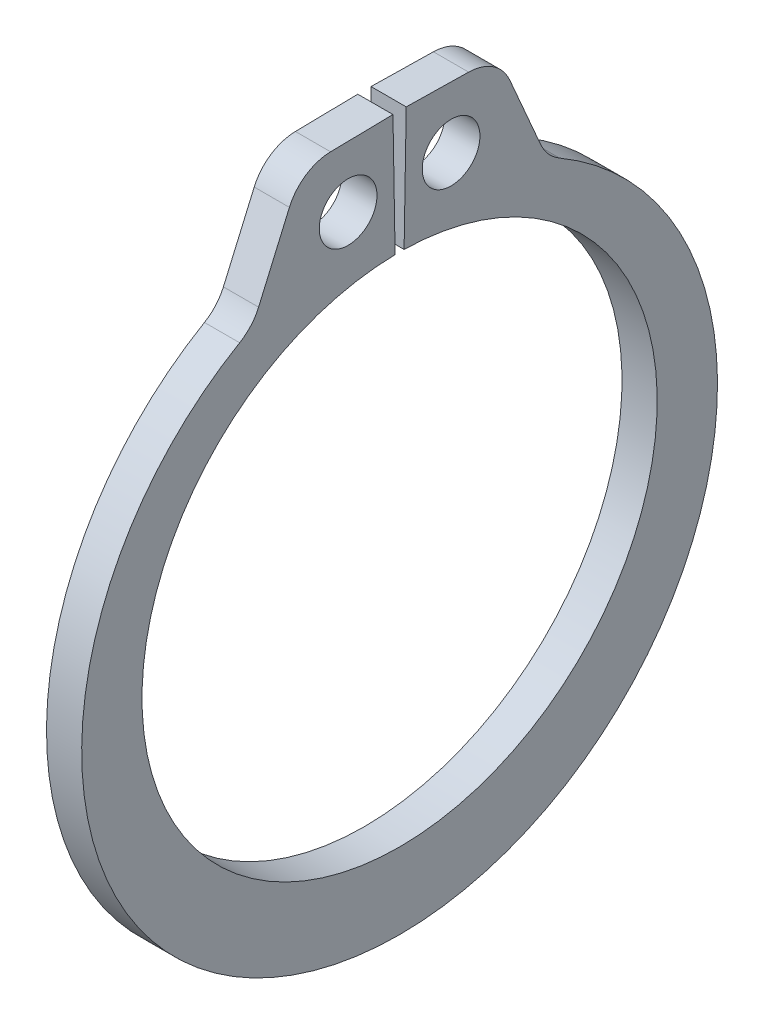
from build123d import *

# Parameters (mm, degrees)
SKETCH1_R      = 0.5207
EXTRUDE1_DEPTH = 0.3175
FILLET1_R      = 0.8255


with BuildPart() as part:
    # Sketch1 → Extrude1 (new, symmetric)
    with BuildSketch(Plane(origin=(0, 0, 0), x_dir=(0, 0, -1), z_dir=(1, 0, 0))):
        with BuildLine():
            Line((-0.081122276, 4.647492057), (-0.119688603, 6.856955493))
            Line((-0.119688603, 6.856955493), (-1.776786181, 6.828030748))
            Line((-1.776786181, 6.828030748), (-2.65598251, 4.800660566))
            ThreePointArc((-2.65598251, 4.800660566), (0, -6.0198), (2.65598251, 4.800660566))
            Line((2.65598251, 4.800660566), (1.776786181, 6.828030748))
            Line((1.776786181, 6.828030748), (0.119688603, 6.856955493))
            Line((0.119688603, 6.856955493), (0.081122276, 4.647492057))
            ThreePointArc((0.081122276, 4.647492057), (0, -4.6482), (-0.081122276, 4.647492057))
        make_face()
        with Locations((-0.928954228, 5.737761402)):
            Circle(SKETCH1_R, mode=Mode.SUBTRACT)
        with Locations((0.928954228, 5.737761402)):
            Circle(SKETCH1_R, mode=Mode.SUBTRACT)
    extrude(amount=EXTRUDE1_DEPTH, both=True)

    # Fillet1
    fillet1_edges = [part.edges().sort_by_distance(p)[0] for p in [
        (0, 6.828030748, -1.776786181),
        (0, 4.800660566, -2.65598251),
        (0, 4.800660566, 2.65598251),
        (0, 6.828030748, 1.776786181),
    ]]
    fillet(fillet1_edges, radius=FILLET1_R)


solid = part.part
